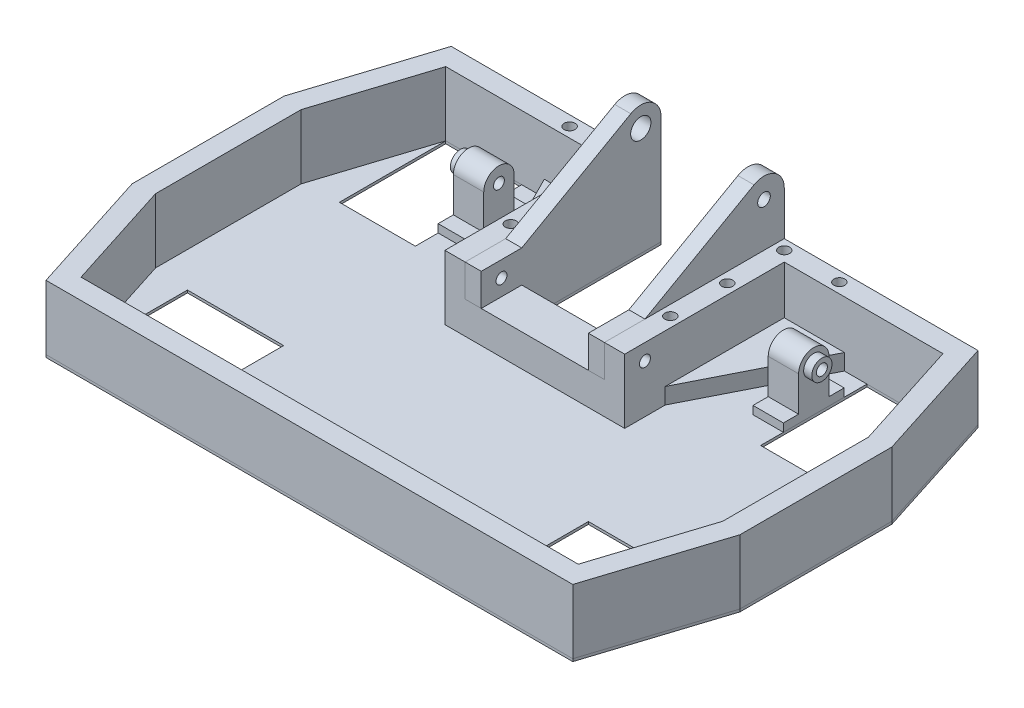
from build123d import *

# Parameters (mm, degrees)
EXTRUDE_THIN1_DEPTH      = 25.4
CUT_EXTRUDE17_REACH      = 203.606
BOSS_EXTRUDE3_DEPTH      = 55
BOSS_EXTRUDE3_2_DEPTH    = 55
CUT_EXTRUDE18_DEPTH      = 205.879970959
SKETCH21_R               = 2.5
CUT_EXTRUDE20_DEPTH      = 224.465634942
SKETCH22_W               = 55
SKETCH22_H               = 8
CUT_EXTRUDE21_DEPTH      = 12.7
BOSS_EXTRUDE4_DEPTH      = 8
SKETCH24_W               = 6.35
SKETCH24_H               = 12.7
BOSS_EXTRUDE5_DEPTH      = 16
BOSS_EXTRUDE6_DEPTH      = 1
SKETCH26_R               = 4
CUT_EXTRUDE22_DEPTH      = 220.323839562
CUT_EXTRUDE23_DEPTH      = 61.5875
CUT_EXTRUDE23_DEPTH_BACK = 31.5875
SKETCH27_R               = 2.159
SKETCH28_W               = 30
SKETCH28_H               = 42
SKETCH28_W_2             = 38
CUT_EXTRUDE24_DEPTH      = 31.5875
SKETCH29_R               = 2.159
CUT_EXTRUDE25_DEPTH      = 31.5875
SKETCH30_R               = 2.159
BOSS_EXTRUDE7_DEPTH      = 12
SKETCH33_R               = 4
SKETCH33_R_2             = 2.159
BOSS_EXTRUDE9_DEPTH      = 3.2


with BuildPart() as part:
    # Sketch1 → Extrude-Thin1 (new body)
    with BuildSketch(Plane(origin=(0, 0, 0), x_dir=(1, 0, 0), z_dir=(0, 1, 0))):
        Polygon((-27.5, -55), (-27.5, 0), (-104, 0), (-120, -50), (-120, -110), (-104, -160), (104, -160), (120, -110), (120, -50), (104, 0), (27.5, 0), (27.5, -55), align=None)
        Polygon((-35.5, -63), (-35.5, -8), (-98.160380961, -8), (-112, -51.248809497), (-112, -108.751190503), (-98.160380961, -152), (98.160380961, -152), (112, -108.751190503), (112, -51.248809497), (98.160380961, -8), (35.5, -8), (35.5, -63), align=None, mode=Mode.SUBTRACT)
    extrude(amount=EXTRUDE_THIN1_DEPTH)

    # Cut-Extrude17: up to this face of the body (flat: up to its plane)
    cut_extrude17_end = Plane(part.part.faces().sort_by_distance((0, 12.7, 55))[0])
    # Sketch19 → Cut-Extrude17 (cut, up to the picked face)
    with BuildSketch(Plane(origin=(0, 0, 0), x_dir=(-1, 0, 0), z_dir=(0, 0, -1)), mode=Mode.PRIVATE) as cut_extrude17_sk1:
        Polygon((-21.15, 0), (-21.15, 50.8), (-27.5, 50.8), (-27.5, 6.35), (-59.25, 6.35), (-59.25, 0), align=None)
    cut_extrude17_tool1 = split(extrude(cut_extrude17_sk1.sketch, amount=-CUT_EXTRUDE17_REACH, mode=Mode.PRIVATE), bisect_by=cut_extrude17_end, keep=Keep.BOTH, mode=Mode.PRIVATE)
    # Sketch19 → Cut-Extrude17 (cut, up to the picked face)
    with BuildSketch(Plane(origin=(0, 0, 0), x_dir=(-1, 0, 0), z_dir=(0, 0, -1)), mode=Mode.PRIVATE) as cut_extrude17_sk2:
        Polygon((59.25, 0), (21.15, 0), (21.15, 50.8), (27.5, 50.8), (27.5, 6.35), (59.25, 6.35), align=None)
    cut_extrude17_tool2 = split(extrude(cut_extrude17_sk2.sketch, amount=-CUT_EXTRUDE17_REACH, mode=Mode.PRIVATE), bisect_by=cut_extrude17_end, keep=Keep.BOTH, mode=Mode.PRIVATE)
    add(cut_extrude17_tool1.solids().sort_by(Axis((21.785, 25.4, 0), (0, 0, 1)))[0], mode=Mode.SUBTRACT)
    add(cut_extrude17_tool2.solids().sort_by(Axis((-40.2, 0.635, 0), (0, 0, 1)))[0], mode=Mode.SUBTRACT)

    # Sketch22 → Cut-Extrude21 (cut)
    with BuildSketch(Plane(origin=(0, 25.4, 0), x_dir=(1, 0, 0), z_dir=(0, 1, 0))):
        with Locations((0, -59)):
            Rectangle(SKETCH22_W, SKETCH22_H)
    extrude(amount=-CUT_EXTRUDE21_DEPTH, mode=Mode.SUBTRACT)

    # Sketch23 → Boss-Extrude4 (add)
    with BuildSketch(Plane.XY.offset(63)):
        Polygon((-27.5, 12.7), (-27.5, 25.4), (-35.5, 25.4), (-35.5, 0), (35.5, 0), (35.5, 25.4), (27.5, 25.4), (27.5, 12.7), align=None)
    extrude(amount=BOSS_EXTRUDE4_DEPTH)


with BuildPart() as body_2:
    # Sketch19<2> → Boss-Extrude3 (new body)
    with BuildSketch(Plane(origin=(0, 0, 0), x_dir=(-1, 0, 0), z_dir=(0, 0, -1))):
        Polygon((-21.15, 0), (-21.15, 50.8), (-27.5, 50.8), (-27.5, 6.35), (-59.25, 6.35), (-59.25, 0), align=None)
    extrude(amount=-BOSS_EXTRUDE3_DEPTH)


with BuildPart() as body_3:
    # Sketch19<2> → Boss-Extrude3 2 (new body)
    with BuildSketch(Plane(origin=(0, 0, 0), x_dir=(-1, 0, 0), z_dir=(0, 0, -1))):
        Polygon((59.25, 0), (21.15, 0), (21.15, 50.8), (27.5, 50.8), (27.5, 6.35), (59.25, 6.35), align=None)
    extrude(amount=-BOSS_EXTRUDE3_2_DEPTH)


with BuildPart() as cut_extrude18_tool:
    # Sketch20 → Cut-Extrude18 (new, through all)
    with BuildSketch(Plane(origin=(0, 6.35, 0), x_dir=(1, 0, 0), z_dir=(0, 1, 0))):
        Polygon((59.25, -8), (35.5, -55), (59.25, -55), align=None)
        Polygon((-35.5, -55), (-59.25, -8), (-59.25, -55), align=None)
    extrude(amount=-CUT_EXTRUDE18_DEPTH)


with BuildPart() as body_2_1:
    add(body_2.part)

    # Cut-Extrude18: cut by cut_extrude18_tool
    add(cut_extrude18_tool.part, mode=Mode.SUBTRACT)


with BuildPart() as body_3_1:
    add(body_3.part)

    # Cut-Extrude18: cut by cut_extrude18_tool
    add(cut_extrude18_tool.part, mode=Mode.SUBTRACT)


with BuildPart() as cut_extrude20_tool:
    # Sketch21 → Cut-Extrude20 (new, through all)
    with BuildSketch(Plane.ZY.offset(27.5)):
        with Locations(Location((8, 42.79, 0), (0, 0, 270))):
            Circle(SKETCH21_R)
        with BuildLine():
            Line((55, 25.4), (11.938203084, 49.753516099))
            ThreePointArc((11.938203084, 49.753516099), (3.969219969, 49.700340971), (0, 42.79))
            Line((0, 42.79), (0, 58.907178906))
            Line((0, 58.907178906), (55, 58.907178906))
            Line((55, 58.907178906), (55, 25.4))
        make_face()
    extrude(amount=-CUT_EXTRUDE20_DEPTH)


with BuildPart() as body_2_2:
    add(body_2_1.part)

    # Cut-Extrude20: cut by cut_extrude20_tool
    add(cut_extrude20_tool.part, mode=Mode.SUBTRACT)


with BuildPart() as body_3_2:
    add(body_3_1.part)

    # Cut-Extrude20: cut by cut_extrude20_tool
    add(cut_extrude20_tool.part, mode=Mode.SUBTRACT)


    add(body_2_2.part)  # Boss-Extrude5 merges body 2
    # Sketch24 → Boss-Extrude5 (add)
    with BuildSketch(Plane.XY.offset(55)):
        with Locations((-24.325, 19.05)):
            Rectangle(SKETCH24_W, SKETCH24_H)
        with Locations((24.325, 19.05)):
            Rectangle(SKETCH24_W, SKETCH24_H)
    extrude(amount=BOSS_EXTRUDE5_DEPTH)

    # Sketch26 → Cut-Extrude22 (cut, through all)
    with BuildSketch(Plane(origin=(-21.15, 0, 0), x_dir=(0, 0, -1), z_dir=(1, 0, 0))):
        with Locations((-8, 42.79)):
            Circle(SKETCH26_R)
    extrude(amount=-CUT_EXTRUDE22_DEPTH, mode=Mode.SUBTRACT)


with BuildPart() as body_3_2_1:
    # Sketch25 → Boss-Extrude6 (new body)
    with BuildSketch(Plane.XZ):
        Polygon((-104, 0), (-21.15, 0), (-21.15, 55), (21.15, 55), (21.15, 0), (104, 0), (120, 50), (120, 110), (104, 160), (-104, 160), (-120, 110), (-120, 50), align=None)
    extrude(amount=BOSS_EXTRUDE6_DEPTH)

    # Sketch28 → Cut-Extrude24 (cut)
    with BuildSketch(Plane(origin=(0, 0, 0), x_dir=(1, 0, 0), z_dir=(0, 1, 0))):
        with Locations((-83.160380961, -29)):
            Rectangle(SKETCH28_W, SKETCH28_H)
        with Locations((-79.160380961, -131)):
            Rectangle(SKETCH28_W_2, SKETCH28_H)
        with Locations((79.160380961, -131)):
            Rectangle(SKETCH28_W_2, SKETCH28_H)
        with Locations((83.160380961, -29)):
            Rectangle(SKETCH28_W, SKETCH28_H)
    extrude(amount=-CUT_EXTRUDE24_DEPTH, mode=Mode.SUBTRACT)


with BuildPart() as cut_extrude23_tool:
    # Sketch27 → Cut-Extrude23 (new, two sides: drawn at the far end of the back side and taken through both)
    with BuildSketch(Plane(origin=(-21.15, 0, 0), x_dir=(0, 0, -1), z_dir=(1, 0, 0)).offset(-CUT_EXTRUDE23_DEPTH_BACK)):
        with Locations(Location((-63, 19.05, 0), (0, 0, 180))):
            Circle(SKETCH27_R)
    extrude(amount=CUT_EXTRUDE23_DEPTH + CUT_EXTRUDE23_DEPTH_BACK)


with BuildPart() as part_1:
    add(part.part)

    # Cut-Extrude23: cut by cut_extrude23_tool
    add(cut_extrude23_tool.part, mode=Mode.SUBTRACT)


with BuildPart() as body_3_3:
    add(body_3_2.part)

    # Cut-Extrude23: cut by cut_extrude23_tool
    add(cut_extrude23_tool.part, mode=Mode.SUBTRACT)


with BuildPart() as cut_extrude25_tool:
    # Sketch29 → Cut-Extrude25 (new body)
    with BuildSketch(Plane(origin=(0, 25.4, 0), x_dir=(1, 0, 0), z_dir=(0, 1, 0))):
        with Locations(Location((-31.5, -49, 0), (0, 0, 270))):
            Circle(SKETCH29_R)
        with Locations(Location((-31.5, -26.5, 0), (0, 0, 270))):
            Circle(SKETCH29_R)
        with Locations(Location((-31.5, -4, 0), (0, 0, 270))):
            Circle(SKETCH29_R)
        with Locations(Location((-53.25, -4, 0), (0, 0, 270))):
            Circle(SKETCH29_R)
        with Locations(Location((53.25, -4, 0), (0, 0, 270))):
            Circle(SKETCH29_R)
        with Locations(Location((31.5, -4, 0), (0, 0, 270))):
            Circle(SKETCH29_R)
        with Locations(Location((31.5, -26.5, 0), (0, 0, 270))):
            Circle(SKETCH29_R)
        with Locations(Location((31.5, -49, 0), (0, 0, 270))):
            Circle(SKETCH29_R)
    extrude(amount=-CUT_EXTRUDE25_DEPTH)


with BuildPart() as part_2:
    add(part_1.part)

    # Cut-Extrude25: cut by cut_extrude25_tool
    add(cut_extrude25_tool.part, mode=Mode.SUBTRACT)


with BuildPart() as body_3_4:
    add(body_3_3.part)

    # Cut-Extrude25: cut by cut_extrude25_tool
    add(cut_extrude25_tool.part, mode=Mode.SUBTRACT)


with BuildPart() as body_3_2_2:
    add(body_3_2_1.part)

    # Cut-Extrude25: cut by cut_extrude25_tool
    add(cut_extrude25_tool.part, mode=Mode.SUBTRACT)


with BuildPart() as body_4:
    # Sketch30 → Boss-Extrude7 (new body)
    with BuildSketch(Plane.ZY.offset(68.160380961)):
        with BuildLine():
            Line((41, 0), (17, 0))
            Line((17, 0), (17, 3.2))
            Line((17, 3.2), (23, 3.2))
            Line((23, 3.2), (23, 17))
            ThreePointArc((23, 17), (29, 23), (35, 17))
            Line((35, 17), (35, 3.2))
            Line((35, 3.2), (41, 3.2))
            Line((41, 3.2), (41, 0))
        make_face()
        with Locations((29, 17)):
            Circle(SKETCH30_R, mode=Mode.SUBTRACT)
    extrude(amount=-BOSS_EXTRUDE7_DEPTH)

    # Sketch33 → Boss-Extrude9 (add)
    with BuildSketch(Plane.ZY.offset(68.160380961)):
        with Locations(Location((29, 17, 0), (0, 0, 180))):
            Circle(SKETCH33_R)
        with Locations((29, 17)):
            Circle(SKETCH33_R_2, mode=Mode.SUBTRACT)
    extrude(amount=BOSS_EXTRUDE9_DEPTH)


with BuildPart() as body_5:
    # Mirror2: mirrored copy
    add(body_4.part.mirror(Plane(origin=(0, 0, 0), x_dir=(0, 0, 1), z_dir=(1, 0, 0))))


solid = Compound([part_2.part, body_3_4.part, body_3_2_2.part, body_4.part, body_5.part])
